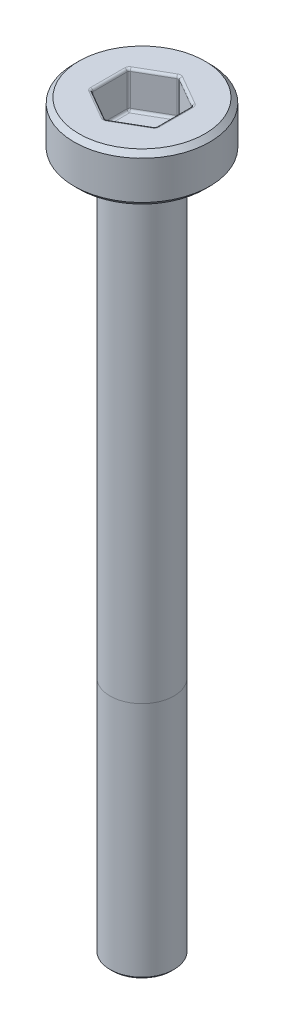
from build123d import *

# Parameters (mm, degrees)
SKETCH1_R           = 1
BOSS_EXTRUDE1_DEPTH = 21.75
SKETCH2_R           = 2.125
BOSS_EXTRUDE2_DEPTH = 1.5
FILLET1_R           = 0.15
CHAMFER1_SIZE       = 0.15
CUT_EXTRUDE1_DEPTH  = 1.15
CHAMFER2_SIZE       = 0.075
FILLET2_R           = 0.075


with BuildPart() as part:
    # Sketch1 → Boss-Extrude1 (new body)
    with BuildSketch(Plane(origin=(0, 0, 0), x_dir=(1, 0, 0), z_dir=(0, 1, 0))):
        with Locations(Location((0, 0, 0), (0, 0, 270))):
            Circle(SKETCH1_R)
    extrude(amount=BOSS_EXTRUDE1_DEPTH)

    # Sketch2 → Boss-Extrude2 (add)
    with BuildSketch(Plane(origin=(0, 21.75, 0), x_dir=(1, 0, 0), z_dir=(0, 1, 0))):
        with Locations(Location((0, 0, 0), (0, 0, 270))):
            Circle(SKETCH2_R)
    extrude(amount=BOSS_EXTRUDE2_DEPTH)

    # Fillet1
    fillet1_edges = [part.edges().sort_by_distance(p)[0] for p in [
        (0, 21.75, -1),
    ]]
    fillet(fillet1_edges, radius=FILLET1_R)

    # Chamfer1
    chamfer1_edges = [part.edges().sort_by_distance(p)[0] for p in [
        (0, 21.75, -2.125),
        (0, 23.25, -2.125),
    ]]
    chamfer(chamfer1_edges, length=CHAMFER1_SIZE)

    # Sketch3 → Cut-Extrude1 (cut)
    with BuildSketch(Plane(origin=(0, 23.25, 0), x_dir=(1, 0, 0), z_dir=(0, 1, 0))):
        Polygon((0, 1.154700538), (-1, 0.577350269), (-1, -0.577350269), (0, -1.154700538), (1, -0.577350269), (1, 0.577350269), align=None)
    extrude(amount=-CUT_EXTRUDE1_DEPTH, mode=Mode.SUBTRACT)

    # Chamfer2
    chamfer2_edges = [part.edges().sort_by_distance(p)[0] for p in [
        (0, 0, -1),
    ]]
    chamfer(chamfer2_edges, length=CHAMFER2_SIZE)

    # Fillet2
    fillet2_edges = [part.edges().sort_by_distance(p)[0] for p in [
        (0.5, 22.1, -0.866025404),
        (0, 22.675, -1.154700538),
        (1, 22.1, 0),
        (1, 22.675, -0.577350269),
        (0.5, 22.1, 0.866025404),
        (1, 22.675, 0.577350269),
        (-0.5, 22.1, 0.866025404),
        (0, 22.675, 1.154700538),
        (-1, 22.1, 0),
        (-1, 22.675, 0.577350269),
        (-0.5, 22.1, -0.866025404),
        (-1, 22.675, -0.577350269),
        (0.5, 23.25, -0.866025404),
        (-0.5, 23.25, -0.866025404),
        (-1, 23.25, 0),
        (-0.5, 23.25, 0.866025404),
        (0.5, 23.25, 0.866025404),
        (1, 23.25, 0),
    ]]
    fillet(fillet2_edges, radius=FILLET2_R)


solid = part.part
